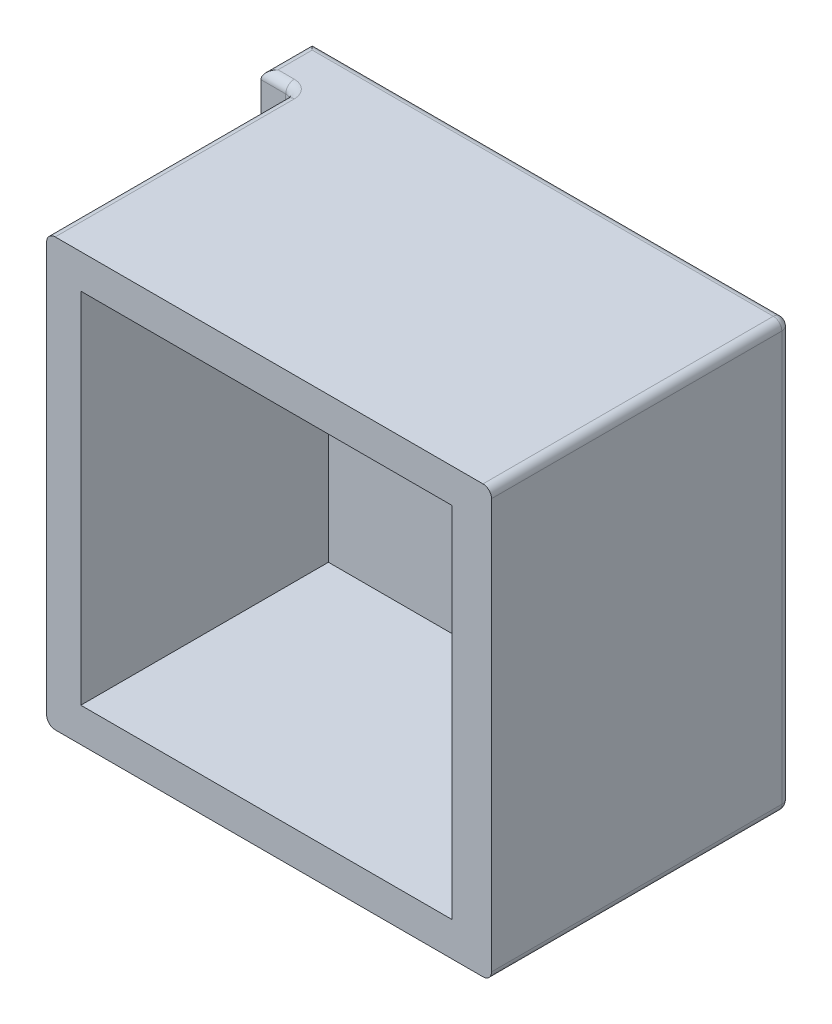
from build123d import *

# Parameters (mm, degrees)
ESBO_O1_W                = 56
ESBO_O1_H                = 50
ESBO_O1_R                = 5
RESSALTO_EXTRUS_O1_DEPTH = 6
ESBO_O2_W                = 52.1
ESBO_O2_H                = 50
ESBO_O2_W_2              = 43.5
ESBO_O2_H_2              = 42
RESSALTO_EXTRUS_O2_DEPTH = 29
FILETE1_R                = 1


with BuildPart() as part:
    # Esboço1 → Ressalto-extrusão1 (new body)
    with BuildSketch(Plane.XY):
        with Locations((4.281632844, -11.096885813)):
            Rectangle(ESBO_O1_W, ESBO_O1_H)
        with Locations((5.491632844, -11.096885813)):
            Circle(ESBO_O1_R, mode=Mode.SUBTRACT)
    extrude(amount=RESSALTO_EXTRUS_O1_DEPTH)

    # Esboço2 → Ressalto-extrusão2 (add)
    with BuildSketch(Plane.XY.offset(6)):
        with Locations((6.231632844, -11.096885813)):
            Rectangle(ESBO_O2_W, ESBO_O2_H)
        with Locations((5.931632844, -11.096885813)):
            Rectangle(ESBO_O2_W_2, ESBO_O2_H_2, mode=Mode.SUBTRACT)
    extrude(amount=RESSALTO_EXTRUS_O2_DEPTH)

    # Filete1
    filete1_edges = [part.edges().sort_by_distance(p)[0] for p in [
        (-21.768367156, 13.903114187, 6),
        (-19.818367156, -11.096885813, 6),
        (-19.818367156, 13.903114187, 20.5),
        (-19.818367156, -36.096885813, 20.5),
        (4.281632844, 13.903114187, 0),
        (32.281632844, -11.096885813, 0),
        (4.281632844, -36.096885813, 0),
        (-23.718367156, 13.903114187, 3),
        (32.281632844, 13.903114187, 17.5),
        (32.281632844, -36.096885813, 17.5),
        (-23.718367156, -36.096885813, 3),
        (-21.768367156, -36.096885813, 6),
    ]]
    fillet(filete1_edges, radius=FILETE1_R)


solid = part.part
